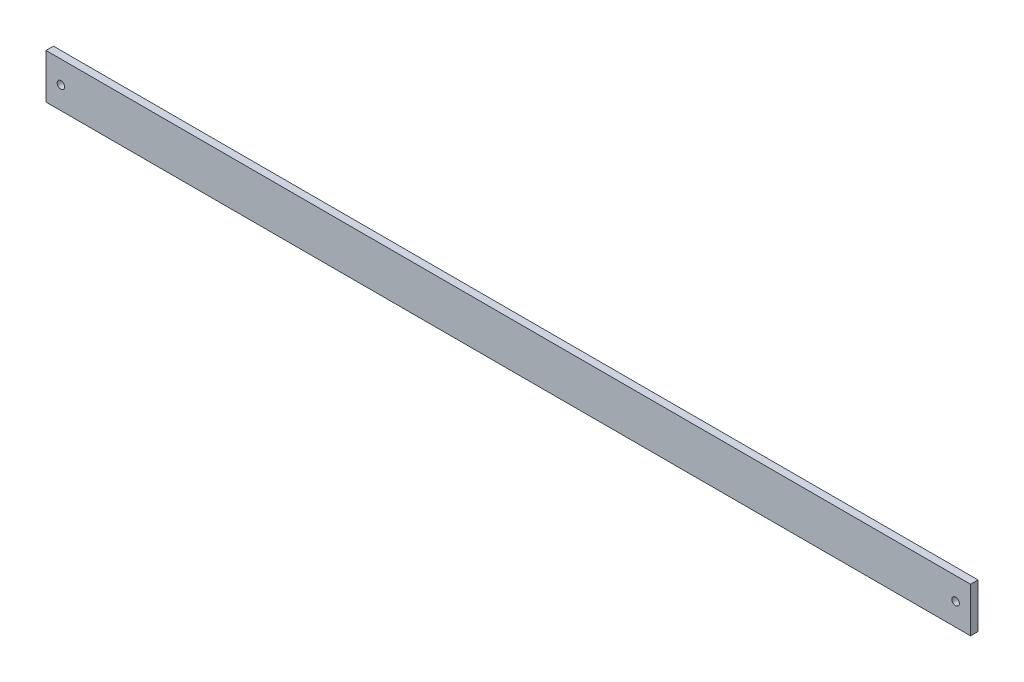
from build123d import *

# Parameters (mm, degrees)
SKETCH7_W           = 393.7
SKETCH7_H           = 19.05
SKETCH7_R           = 1.5875
BOSS_EXTRUDE1_DEPTH = 3.175


with BuildPart() as part:
    # Sketch7 → Boss-Extrude1 (new body)
    with BuildSketch(Plane.XY):
        with Locations((196.85, 9.525)):
            Rectangle(SKETCH7_W, SKETCH7_H)
        with Locations((6.35, 9.525)):
            Circle(SKETCH7_R, mode=Mode.SUBTRACT)
        with Locations((387.35, 9.525)):
            Circle(SKETCH7_R, mode=Mode.SUBTRACT)
    extrude(amount=BOSS_EXTRUDE1_DEPTH)


solid = part.part
